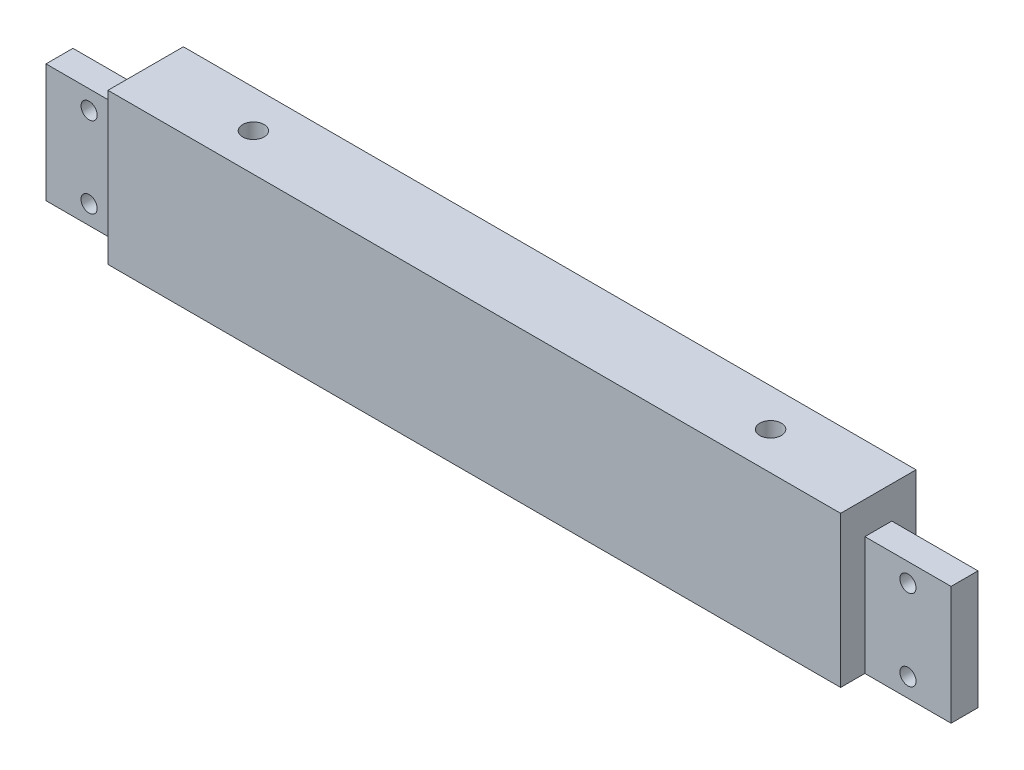
from build123d import *

# Parameters (mm, degrees)
SKETCH1_W           = 431.8
SKETCH1_H           = 88.9
BOSS_EXTRUDE1_DEPTH = 22.225
SKETCH2_W           = 15.875
SKETCH2_H           = 69.85
BOSS_EXTRUDE2_DEPTH = 50.8
SKETCH3_R           = 4.7625
CUT_EXTRUDE1_DEPTH  = 273.056003253
SKETCH5_R           = 6.35
CUT_EXTRUDE3_DEPTH  = 283.003635836


with BuildPart() as part:
    # Sketch1 → Boss-Extrude1 (new, symmetric)
    with BuildSketch(Plane.XY):
        Rectangle(SKETCH1_W, SKETCH1_H)
    extrude(amount=BOSS_EXTRUDE1_DEPTH, both=True)

    # Sketch2 → Boss-Extrude2 (add)
    with BuildSketch(Plane(origin=(215.9, 0, 0), x_dir=(0, 0, -1), z_dir=(1, 0, 0))):
        with Locations((0, -9.525)):
            Rectangle(SKETCH2_W, SKETCH2_H)
    boss_extrude2 = extrude(amount=BOSS_EXTRUDE2_DEPTH)

    # Sketch3 → Cut-Extrude1 (cut, through all)
    with BuildSketch(Plane.XY.offset(7.9375)):
        with Locations((241.3, 14.2875)):
            Circle(SKETCH3_R)
        with Locations((241.3, -33.3375)):
            Circle(SKETCH3_R)
    cut_extrude1 = extrude(amount=-CUT_EXTRUDE1_DEPTH, mode=Mode.SUBTRACT)

    # Mirror1: Boss-Extrude2, Cut-Extrude1 across plane
    add(boss_extrude2.mirror(Plane(origin=(0, 0, 0), x_dir=(0, 0, 1), z_dir=(1, 0, 0))))
    add(cut_extrude1.mirror(Plane(origin=(0, 0, 0), x_dir=(0, 0, 1), z_dir=(1, 0, 0))), mode=Mode.SUBTRACT)

    # Sketch5 → Cut-Extrude3 (cut, through all)
    with BuildSketch(Plane(origin=(0, 44.45, 0), x_dir=(1, 0, 0), z_dir=(0, 1, 0))):
        with Locations(Location((-152.4, 0, 0), (0, 0, 180))):
            Circle(SKETCH5_R)
        with Locations(Location((152.4, 0, 0), (0, 0, 180))):
            Circle(SKETCH5_R)
    extrude(amount=-CUT_EXTRUDE3_DEPTH, mode=Mode.SUBTRACT)


solid = part.part
